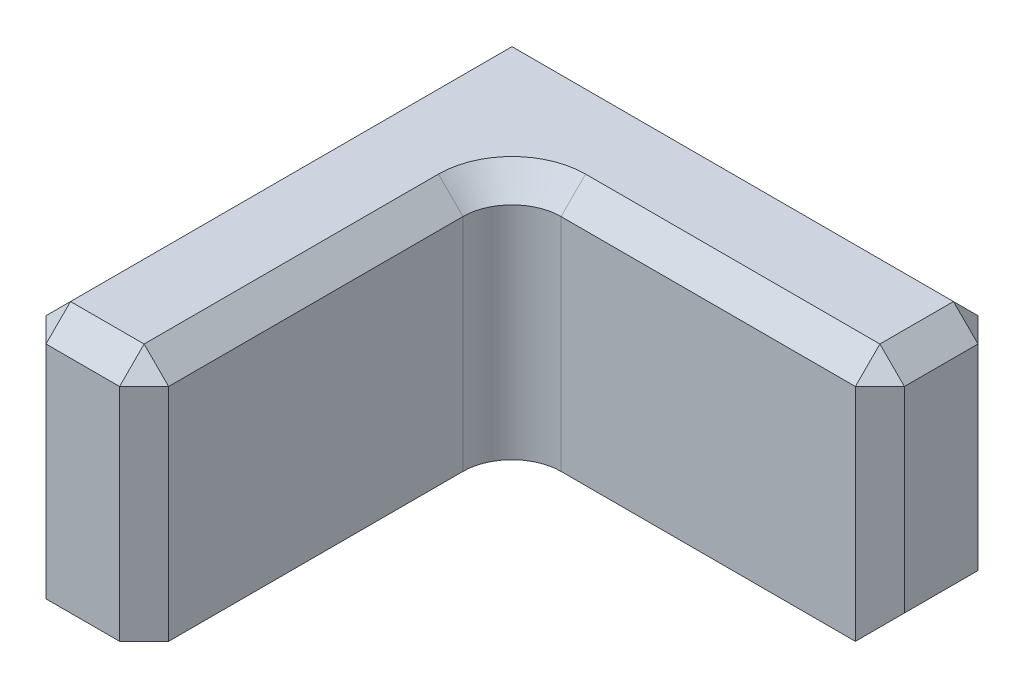
from build123d import *

# Parameters (mm, degrees)
EXTRUDE_1_DEPTH = 10
FILLET_1_R      = 2
CHAMFER_1_SIZE  = 1


with BuildPart() as part:
    # 草图1 → 凸台-拉伸1 (new body)
    with BuildSketch(Plane(origin=(0, 0, 0), x_dir=(1, 0, 0), z_dir=(0, 1, 0))):
        Polygon((5, 0), (0, 0), (0, -5), (0, -20), (5, -20), (5, -5), (20, -5), (20, 0), align=None)
    extrude(amount=EXTRUDE_1_DEPTH)

    # 圆角1
    fillet_1_edges = [part.edges().sort_by_distance(p)[0] for p in [
        (5, 5, 5),
    ]]
    fillet(fillet_1_edges, radius=FILLET_1_R)

    # 倒角1
    chamfer_1_edges = [part.edges().sort_by_distance(p)[0] for p in [
        (20, 0, 2.5),
        (10, 10, 0),
        (20, 5, 5),
        (5, 5, 20),
        (0, 5, 20),
        (0, 5, 0),
        (20, 5, 0),
        (0, 10, 10),
        (2.5, 10, 20),
        (13.5, 10, 5),
        (5, 10, 13.5),
        (5.585786438, 10, 5.585786438),
        (20, 10, 2.5),
    ]]
    chamfer(chamfer_1_edges, length=CHAMFER_1_SIZE)


solid = part.part
